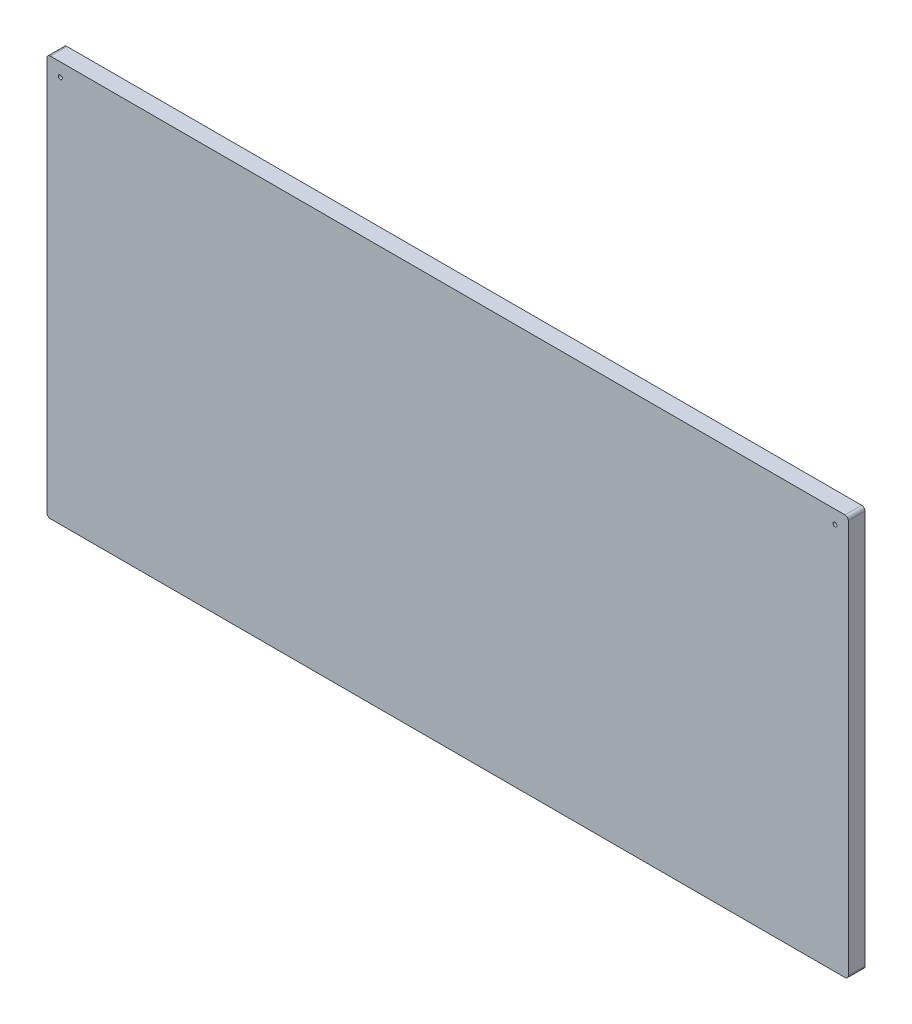
from build123d import *

# Parameters (mm, degrees)
BOSS_EXTRUDE1_DEPTH = 25
SKETCH2_R           = 3
CUT_EXTRUDE1_DEPTH  = 27.5


with BuildPart() as part:
    # Sketch1 → Boss-Extrude1 (new body)
    with BuildSketch(Plane.XY):
        with BuildLine():
            Line((-595, -300), (595, -300))
            ThreePointArc((595, -300), (598.535533906, -298.535533906), (600, -295))
            Line((600, -295), (600, 295))
            ThreePointArc((600, 295), (598.535533906, 298.535533906), (595, 300))
            Line((595, 300), (-595, 300))
            ThreePointArc((-595, 300), (-598.535533906, 298.535533906), (-600, 295))
            Line((-600, 295), (-600, -295))
            ThreePointArc((-600, -295), (-598.535533906, -298.535533906), (-595, -300))
        make_face()
    extrude(amount=-BOSS_EXTRUDE1_DEPTH)

    # Sketch2 → Cut-Extrude1 (cut)
    with BuildSketch(Plane.XY):
        with Locations((580, 280)):
            Circle(SKETCH2_R)
        with Locations((-580, 280)):
            Circle(SKETCH2_R)
    extrude(amount=-CUT_EXTRUDE1_DEPTH, mode=Mode.SUBTRACT)


solid = part.part
